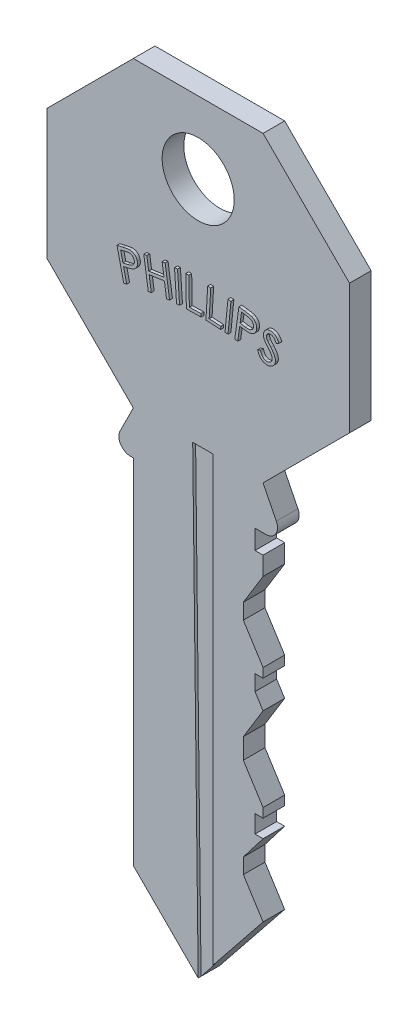
from build123d import *

# Parameters (mm, degrees)
CROQUIS1_W              = 21
CROQUIS1_H              = 21
SALIENTE_EXTRUIR1_DEPTH = 1.5
CROQUIS2_R              = 2.5
CORTAR_EXTRUIR1_DEPTH   = 1.5
SALIENTE_EXTRUIR2_DEPTH = 1.5
REDONDEO1_R             = 0.8
CORTAR_EXTRUIR2_DEPTH   = 1.5
CORTAR_EXTRUIR3_DEPTH   = 0.2
SALIENTE_EXTRUIR3_DEPTH = 0.2


with BuildPart() as part:
    # Croquis1 → Saliente-Extruir1 (new body)
    with BuildSketch(Plane.XY):
        Rectangle(CROQUIS1_W, CROQUIS1_H)
    extrude(amount=SALIENTE_EXTRUIR1_DEPTH)

    # Croquis2 → Cortar-Extruir1 (cut)
    with BuildSketch(Plane.XY.offset(1.5)):
        with Locations((0, 5.5)):
            Circle(CROQUIS2_R)
        Polygon((-10.5, 4.5), (-4.5, 10.5), (-10.029650862, 11.989113264), (-12.962341251, 10.5), align=None)
        Polygon((12.962341251, 10.5), (10.029650862, 11.989113264), (4.5, 10.5), (10.5, 4.5), align=None)
        Polygon((10.029650862, -11.989113264), (4.5, -10.5), (10.5, -4.5), (12.962341251, -10.5), align=None)
        Polygon((-10.029650862, -11.989113264), (-4.5, -10.5), (-10.5, -4.5), (-12.962341251, -10.5), align=None)
    extrude(amount=-CORTAR_EXTRUIR1_DEPTH, mode=Mode.SUBTRACT)

    # Croquis3 → Saliente-Extruir2 (add)
    with BuildSketch(Plane.XY.offset(1.5)):
        Polygon((-4.5, -10.5), (-6, -13.5), (-4.5, -13.5), (-4.5, -38), (0, -42.5), (4.5, -38), (4.5, -13.5), (6, -13.5), (4.5, -10.5), align=None)
    extrude(amount=-SALIENTE_EXTRUIR2_DEPTH)

    # Redondeo1
    redondeo1_edges = [part.edges().sort_by_distance(p)[0] for p in [
        (6, -13.5, 0.75),
        (-6, -13.5, 0.75),
    ]]
    fillet(redondeo1_edges, radius=REDONDEO1_R)

    # Croquis4 → Cortar-Extruir2 (cut)
    with BuildSketch(Plane.XY.offset(1.5)):
        Polygon((4.5, -13.5), (3.944152293, -13.5), (3.944152293, -14.839652089), (4.5, -14.839652089), (4.5, -16.123338429), (3.133403026, -18.352898915), (3.133403026, -19.433897938), (4.5, -21.595895985), (4.5, -22.237739155), (3.944152293, -22.237739155), (3.944152293, -23.318738178), (4.5, -24.198106184), (3.133403026, -26.427666669), (3.133403026, -27.846097212), (4.5, -30.008095259), (4.5, -30.649317108), (3.944152293, -30.649317108), (3.944152293, -31.879924867), (4.5, -31.879924867), (3.133403026, -33.659573012), (3.133403026, -34.719788927), (4.5, -36.881786974), (0, -42.5), (6.693882672, -39.265767585), (9.601874389, -27.136881941), align=None)
    extrude(amount=-CORTAR_EXTRUIR2_DEPTH, mode=Mode.SUBTRACT)

    # Croquis5 → Cortar-Extruir3 (cut)
    with BuildSketch(Plane.XY.offset(1.5)):
        Polygon((0, -42.5), (-0.381234515, -10.5), (1.019575306, -10.5), (1.019575306, -41.227068608), align=None)
    extrude(amount=-CORTAR_EXTRUIR3_DEPTH, mode=Mode.SUBTRACT)

    # Croquis6 → Saliente-Extruir3 (add)
    # profile 1 of 8: a face of its own
    with BuildSketch(Plane.XY.offset(1.5)):
        with BuildLine():
            Line((-5.431672509, -1.091944484), (-5.024197215, -0.998661898))
            add(Edge.make_bspline(
                [(-5.024197215, -0.998661898), (-4.996085863, -0.992375574), (-4.942329592, -0.980354476), (-4.865022948, -0.964180371), (-4.794639874, -0.950544968), (-4.731172174, -0.939479576), (-4.67463325, -0.930915996), (-4.62503631, -0.924697823), (-4.582135463, -0.92164239), (-4.555808977, -0.921247844), (-4.5437919, -0.921067748)],
                knots=[0, 0, 0, 0, 1.418251892, 2.712069135, 3.888501382, 4.947889383, 5.883818778, 6.703809145, 7.408336306, 8, 8, 8, 8], degree=3))
            add(Edge.make_bspline(
                [(-4.5437919, -0.921067748), (-4.528512619, -0.921702267), (-4.498428284, -0.922951612), (-4.45402837, -0.928492029), (-4.410948154, -0.937496806), (-4.369155748, -0.949558327), (-4.328843068, -0.965603841), (-4.289792337, -0.984622983), (-4.252133474, -1.007135928), (-4.21609162, -1.032587088), (-4.181900607, -1.060806756), (-4.151205777, -1.092963773), (-4.12227739, -1.127185784), (-4.09757897, -1.16521071), (-4.075156183, -1.205758158), (-4.056378525, -1.249459207), (-4.039899502, -1.295998586), (-4.03187627, -1.328462781), (-4.027769598, -1.3450795)],
                knots=[0, 0, 0, 0, 1.013006225, 1.994571563, 2.960690979, 3.926810396, 4.87288566, 5.832034986, 6.802140658, 7.77653137, 8.753798254, 9.73397761, 10.718442704, 11.718465043, 12.732725925, 13.785389559, 14.86645701, 16, 16, 16, 16], degree=3))
            add(Edge.make_bspline(
                [(-4.027769598, -1.3450795), (-4.02428606, -1.361855859), (-4.017472845, -1.394667598), (-4.011372834, -1.443714762), (-4.009920541, -1.491218739), (-4.011269137, -1.537481404), (-4.017316677, -1.582170065), (-4.026959694, -1.625557968), (-4.041314451, -1.667083003), (-4.058340187, -1.707503751), (-4.079997815, -1.745594694), (-4.103819806, -1.782307075), (-4.131923037, -1.816170895), (-4.162218904, -1.848839871), (-4.196847025, -1.878140039), (-4.23403271, -1.90596197), (-4.274178876, -1.93207132), (-4.303093119, -1.946863685), (-4.317793636, -1.954384388)],
                knots=[0, 0, 0, 0, 1.118491015, 2.187580456, 3.221808766, 4.219148274, 5.205842779, 6.161762592, 7.116032843, 8.070882995, 9.020994407, 9.973120429, 10.924351595, 11.890462266, 12.878407472, 13.880602315, 14.922460382, 16, 16, 16, 16], degree=3))
            add(Edge.make_bspline(
                [(-4.317793636, -1.954384388), (-4.330035319, -1.960024961), (-4.356750169, -1.972334303), (-4.401465226, -1.989368635), (-4.453688918, -2.007751286), (-4.514063517, -2.026122405), (-4.582026995, -2.045597862), (-4.657855496, -2.065448101), (-4.741387294, -2.086247036), (-4.799876179, -2.099898638), (-4.830423845, -2.107028619)],
                knots=[0, 0, 0, 0, 0.60366241, 1.317363924, 2.142366788, 3.083624026, 4.143800012, 5.309447408, 6.594774019, 8, 8, 8, 8], degree=3))
            Line((-4.830423845, -2.107028619), (-4.976707899, -2.140525547))
            Line((-4.976707899, -2.140525547), (-4.758765859, -3.092007919))
            Line((-4.758765859, -3.092007919), (-4.963139523, -3.138649211))
            Line((-4.963139523, -3.138649211), (-5.431672509, -1.091944484))
        make_face()
        with BuildLine():
            Line((-5.181929587, -1.244164703), (-5.022501168, -1.939967988))
            Line((-5.022501168, -1.939967988), (-4.675235543, -1.864917908))
            add(Edge.make_bspline(
                [(-4.675235543, -1.864917908), (-4.658248679, -1.860925433), (-4.625573433, -1.853245669), (-4.578654008, -1.840408531), (-4.535704852, -1.827310706), (-4.496212844, -1.814343492), (-4.460889953, -1.800165394), (-4.428814718, -1.786651753), (-4.401231692, -1.771434274), (-4.369164038, -1.752171455), (-4.334711398, -1.724656437), (-4.299870081, -1.686872027), (-4.271449458, -1.644472088), (-4.250527339, -1.597628834), (-4.235945677, -1.548274558), (-4.229363318, -1.497119582), (-4.229189089, -1.445010357), (-4.235940177, -1.41073565), (-4.239351462, -1.39341684)],
                knots=[0, 0, 0, 0, 1.14451667, 2.201546071, 3.189871822, 4.089899925, 4.926582907, 5.686219818, 6.370625557, 6.990727912, 8.138880893, 9.24769648, 10.350761232, 11.470951561, 12.600501644, 13.713649465, 14.844720316, 16, 16, 16, 16], degree=3))
            add(Edge.make_bspline(
                [(-4.239351462, -1.39341684), (-4.243987633, -1.376726491), (-4.253131183, -1.34380945), (-4.274737072, -1.297171669), (-4.303333309, -1.254772022), (-4.337779421, -1.216752653), (-4.376185203, -1.18362745), (-4.41900452, -1.157873446), (-4.464645815, -1.138827239), (-4.505696955, -1.129780357), (-4.540881046, -1.125805522), (-4.570940804, -1.125102143), (-4.604190568, -1.126536726), (-4.640946962, -1.129651602), (-4.681052756, -1.134043839), (-4.724361042, -1.141684541), (-4.771029636, -1.150481059), (-4.803161414, -1.157446451), (-4.819823551, -1.161058399)],
                knots=[0, 0, 0, 0, 1.164258512, 2.296174013, 3.441002044, 4.592605197, 5.739761761, 6.840767675, 7.941116125, 9.053198795, 9.656072046, 10.32210586, 11.074007543, 11.894648899, 12.804219987, 13.787711987, 14.85280401, 16, 16, 16, 16], degree=3))
            Line((-4.819823551, -1.161058399), (-5.181929587, -1.244164703))
        make_face(mode=Mode.SUBTRACT)
    # profile 2 of 8: a face of its own
    with BuildSketch(Plane.XY.offset(1.5)):
        Polygon((-3.572864861, -0.694461023), (-3.362979044, -0.663084153), (-3.23365546, -1.537820398), (-2.173202067, -1.381360061), (-2.302525652, -0.506623817), (-2.092639835, -0.475670959), (-1.784383291, -2.561384767), (-1.994269108, -2.592337625), (-2.143097233, -1.585733726), (-3.203550625, -1.742194062), (-3.0547225, -2.748797962), (-3.264608317, -2.780174831), align=None)
    # profile 3 of 8: a face of its own
    with BuildSketch(Plane.XY.offset(1.5)):
        Polygon((-1.443856263, -0.434787949), (-1.233546434, -0.420371549), (-1.090230462, -2.525589899), (-1.300540291, -2.540006298), align=None)
    # profile 4 of 8: a face of its own
    with BuildSketch(Plane.XY.offset(1.5)):
        Polygon((-0.663567699, -0.400348756), (-0.451561823, -0.396108639), (-0.41212873, -2.298225359), (0.396461682, -2.281264889), (0.400701799, -2.484366518), (-0.619894488, -2.505567106), align=None)
    # profile 5 of 8: a face of its own
    with BuildSketch(Plane.XY.offset(1.5)):
        Polygon((0.859241981, -0.39331503), (1.071247857, -0.405611371), (0.961852825, -2.307728091), (1.770443236, -2.354369384), (1.758570907, -2.557471013), (0.73797462, -2.49853338), align=None)
    # profile 6 of 8: a face of its own
    with BuildSketch(Plane.XY.offset(1.5)):
        Polygon((2.264071213, -0.479871029), (2.472684995, -0.500223593), (2.268311331, -2.585937402), (2.059697549, -2.565584838), align=None)
    # profile 7 of 8: a face of its own
    with BuildSketch(Plane.XY.offset(1.5)):
        with BuildLine():
            Line((3.026762536, -0.552738335), (3.442294053, -0.610403933))
            add(Edge.make_bspline(
                [(3.442294053, -0.610403933), (3.470855337, -0.614426795), (3.525624955, -0.622141107), (3.60394084, -0.634397027), (3.674779472, -0.646604745), (3.738109819, -0.658905296), (3.794149007, -0.671022826), (3.842711354, -0.683436643), (3.884191996, -0.694672611), (3.90862422, -0.704075862), (3.919731286, -0.708350648)],
                knots=[0, 0, 0, 0, 1.417789489, 2.718777917, 3.896378826, 4.950985233, 5.889930242, 6.71390826, 7.415333406, 8, 8, 8, 8], degree=3))
            add(Edge.make_bspline(
                [(3.919731286, -0.708350648), (3.9338249, -0.714352072), (3.961654562, -0.726202661), (4.001187199, -0.747557973), (4.038216345, -0.771504755), (4.073237408, -0.797524513), (4.104875976, -0.827219008), (4.134929598, -0.858670609), (4.162451254, -0.892902799), (4.186955204, -0.929894453), (4.20868745, -0.968737156), (4.226491634, -1.009527214), (4.240493194, -1.051991963), (4.25146126, -1.095994721), (4.256914009, -1.142118429), (4.259606823, -1.189708034), (4.258374331, -1.239071587), (4.254536435, -1.272308218), (4.252580511, -1.289246748)],
                knots=[0, 0, 0, 0, 1.012867312, 2.00003734, 2.967351041, 3.928455086, 4.881247219, 5.83358055, 6.804546972, 7.782107545, 8.76555172, 9.745211263, 10.720847546, 11.720861352, 12.739022095, 13.787632888, 14.872501595, 16, 16, 16, 16], degree=3))
            add(Edge.make_bspline(
                [(4.252580511, -1.289246748), (4.249854052, -1.306253307), (4.244522129, -1.339511707), (4.232577707, -1.387750688), (4.217333084, -1.433101935), (4.199094455, -1.475673511), (4.177824005, -1.515509474), (4.153045197, -1.552396398), (4.125562726, -1.587034818), (4.094459775, -1.61829137), (4.060891366, -1.646668884), (4.025229939, -1.67242901), (3.986918918, -1.69421895), (3.946765586, -1.713564303), (3.904261857, -1.729790029), (3.859324851, -1.742162654), (3.812369796, -1.752344201), (3.78013481, -1.755943891), (3.763694961, -1.757779734)],
                knots=[0, 0, 0, 0, 1.120605591, 2.19148094, 3.229944167, 4.231239178, 5.202507356, 6.164320874, 7.119646462, 8.075813104, 9.02865548, 9.978206508, 10.934328902, 11.892970145, 12.877004196, 13.890353063, 14.924079645, 16, 16, 16, 16], degree=3))
            add(Edge.make_bspline(
                [(3.763694961, -1.757779734), (3.750274484, -1.758779375), (3.720921824, -1.760965743), (3.672937761, -1.760982889), (3.617370719, -1.759242443), (3.554318626, -1.755286418), (3.483614269, -1.749391552), (3.405506967, -1.740592838), (3.319672934, -1.730588924), (3.260098012, -1.722543933), (3.229016141, -1.718346641)],
                knots=[0, 0, 0, 0, 0.601266309, 1.315062545, 2.142914088, 3.085792928, 4.138059921, 5.313427469, 6.59834143, 8, 8, 8, 8], degree=3))
            Line((3.229016141, -1.718346641), (3.080188016, -1.697570065))
            Line((3.080188016, -1.697570065), (2.945776291, -2.667284942))
            Line((2.945776291, -2.667284942), (2.737162509, -2.638452143))
            Line((2.737162509, -2.638452143), (3.026762536, -0.552738335))
        make_face()
        with BuildLine():
            Line((3.20696753, -0.784248751), (3.108596804, -1.493196401))
            Line((3.108596804, -1.493196401), (3.46095057, -1.54619787))
            add(Edge.make_bspline(
                [(3.46095057, -1.54619787), (3.478188248, -1.548354699), (3.511501209, -1.552522915), (3.559800245, -1.557958909), (3.604808666, -1.560613741), (3.646363025, -1.562704966), (3.684583651, -1.56223673), (3.7192271, -1.560053259), (3.750608224, -1.556995437), (3.787337025, -1.549658141), (3.829505236, -1.536157507), (3.875637395, -1.513068444), (3.917643165, -1.483548523), (3.953692541, -1.446678554), (3.985222326, -1.405654808), (4.009374936, -1.359932351), (4.027891479, -1.311130175), (4.034050415, -1.276667766), (4.037182541, -1.259141914)],
                knots=[0, 0, 0, 0, 1.136516206, 2.196393175, 3.17861268, 4.08548325, 4.917682056, 5.677268992, 6.356274008, 6.978240609, 8.124456561, 9.240899508, 10.341532932, 11.466063387, 12.601488362, 13.714288119, 14.837601549, 16, 16, 16, 16], degree=3))
            add(Edge.make_bspline(
                [(4.037182541, -1.259141914), (4.038823075, -1.241913484), (4.042064933, -1.207868398), (4.037976906, -1.156645012), (4.026462531, -1.106811695), (4.007659708, -1.05894991), (3.983087772, -1.014415012), (3.952588874, -0.974553976), (3.916226637, -0.94086599), (3.881254902, -0.917655741), (3.849763981, -0.90119206), (3.821823894, -0.890072441), (3.790094449, -0.879402671), (3.754658103, -0.869478873), (3.715429867, -0.859488606), (3.672197991, -0.850911524), (3.625176307, -0.842235399), (3.592413646, -0.837555574), (3.575433743, -0.835130162)],
                knots=[0, 0, 0, 0, 1.160107035, 2.292486556, 3.431841461, 4.582480303, 5.733588538, 6.836279487, 7.9373771, 9.045321995, 9.643711973, 10.320343134, 11.061494696, 11.890439658, 12.790266228, 13.778412631, 14.848618041, 16, 16, 16, 16], degree=3))
            Line((3.575433743, -0.835130162), (3.20696753, -0.784248751))
        make_face(mode=Mode.SUBTRACT)
    # profile 8 of 8: a face of its own
    with BuildSketch(Plane.XY.offset(1.5)):
        with BuildLine():
            Line((4.325291999, -2.487044592), (4.522881476, -2.422170793))
            add(Edge.make_bspline(
                [(4.522881476, -2.422170793), (4.531961274, -2.452319128), (4.549341921, -2.510029392), (4.582675661, -2.589961935), (4.619171275, -2.660377671), (4.66089987, -2.720152416), (4.706594111, -2.770436672), (4.756899345, -2.810236626), (4.811623437, -2.840312929), (4.850929472, -2.851294989), (4.870571113, -2.856782839)],
                knots=[0, 0, 0, 0, 1.291853408, 2.472879578, 3.550092808, 4.541686389, 5.457391863, 6.329172418, 7.16506983, 8, 8, 8, 8], degree=3))
            add(Edge.make_bspline(
                [(4.870571113, -2.856782839), (4.887615716, -2.860067461), (4.921352247, -2.866568741), (4.972818673, -2.868243752), (5.024108156, -2.864717435), (5.074522697, -2.85404202), (5.122617611, -2.837612386), (5.167236112, -2.816117377), (5.207021745, -2.788532597), (5.242283646, -2.756319694), (5.272302894, -2.719977189), (5.296507057, -2.680616894), (5.315870243, -2.639009532), (5.323702876, -2.609590512), (5.327655782, -2.594743577)],
                knots=[0, 0, 0, 0, 1.064757967, 2.107484569, 3.152233221, 4.216424714, 5.262471191, 6.268105896, 7.248233143, 8.225279432, 9.193491207, 10.133099009, 11.05782868, 12, 12, 12, 12], degree=3))
            add(Edge.make_bspline(
                [(5.327655782, -2.594743577), (5.330642416, -2.577412778), (5.336684625, -2.542351135), (5.334963286, -2.487805884), (5.324201073, -2.432073125), (5.310805788, -2.395863133), (5.303911123, -2.377225548)],
                knots=[0, 0, 0, 0, 0.947869012, 1.917617609, 2.928180434, 4, 4, 4, 4], degree=3))
            add(Edge.make_bspline(
                [(5.303911123, -2.377225548), (5.297820365, -2.363596847), (5.284970927, -2.334844901), (5.26206136, -2.290870954), (5.234225168, -2.244181565), (5.202059508, -2.194615778), (5.164804725, -2.142393295), (5.123437393, -2.087073544), (5.077514009, -2.02880064), (5.044797342, -1.989598016), (5.027879473, -1.969326242)],
                knots=[0, 0, 0, 0, 0.724804189, 1.529091489, 2.406033567, 3.363605743, 4.397647578, 5.520513595, 6.717851405, 8, 8, 8, 8], degree=3))
            add(Edge.make_bspline(
                [(5.027879473, -1.969326242), (5.011006535, -1.949159656), (4.978849982, -1.910726045), (4.933636374, -1.854986447), (4.893943611, -1.80392795), (4.859415632, -1.757583345), (4.830069627, -1.716061554), (4.805809909, -1.679296195), (4.786675768, -1.647219004), (4.777281219, -1.626659695), (4.77304841, -1.617396488)],
                knots=[0, 0, 0, 0, 1.448791507, 2.761116266, 3.954352388, 5.011922334, 5.945301079, 6.755289071, 7.43918277, 8, 8, 8, 8], degree=3))
            add(Edge.make_bspline(
                [(4.77304841, -1.617396488), (4.767017199, -1.603354322), (4.755126846, -1.575670607), (4.741593992, -1.533073416), (4.731900951, -1.490635752), (4.725394068, -1.448265977), (4.722474231, -1.406004179), (4.722836774, -1.363603773), (4.726892259, -1.321260766), (4.732784665, -1.293407208), (4.735735376, -1.279459121)],
                knots=[0, 0, 0, 0, 1.059114621, 2.088013168, 3.0935466, 4.074767526, 5.057113285, 6.027311119, 7.012146491, 8, 8, 8, 8], degree=3))
            add(Edge.make_bspline(
                [(4.735735376, -1.279459121), (4.741356532, -1.25777878), (4.752449254, -1.214995057), (4.779280519, -1.154904031), (4.81305778, -1.099595066), (4.853835063, -1.049520495), (4.900902187, -1.005254696), (4.95377302, -0.968219076), (5.011863767, -0.938551431), (5.074421884, -0.916939981), (5.139710746, -0.902226572), (5.20656578, -0.897103088), (5.274200577, -0.898998218), (5.318690943, -0.907804693), (5.341224158, -0.912264944)],
                knots=[0, 0, 0, 0, 1.01908457, 2.01104917, 2.985231066, 3.964889633, 4.944484694, 5.920006754, 6.896399995, 7.906655493, 8.928605263, 9.936744266, 10.955014545, 12, 12, 12, 12], degree=3))
            add(Edge.make_bspline(
                [(5.341224158, -0.912264944), (5.364764908, -0.918544899), (5.411510279, -0.93101514), (5.477557651, -0.961100194), (5.539724049, -0.998433852), (5.587357277, -1.037232918), (5.623124716, -1.073351524), (5.650604443, -1.103758748), (5.676559145, -1.138974751), (5.703048218, -1.177305639), (5.728207962, -1.220117192), (5.753970572, -1.266197265), (5.778150968, -1.316770117), (5.793993141, -1.351795227), (5.802124932, -1.369773625)],
                knots=[0, 0, 0, 0, 1.293395107, 2.568322243, 3.84287286, 5.140865654, 5.820992122, 6.544875647, 7.317362517, 8.144800739, 9.021123634, 9.956086172, 10.95085855, 12, 12, 12, 12], degree=3))
            Line((5.802124932, -1.369773625), (5.606231503, -1.458392081))
            add(Edge.make_bspline(
                [(5.606231503, -1.458392081), (5.599665354, -1.443940205), (5.587033121, -1.416137076), (5.567517607, -1.376467173), (5.547958527, -1.340506993), (5.529084431, -1.307843535), (5.510302675, -1.278909888), (5.492177265, -1.253223102), (5.473935946, -1.231208744), (5.450505235, -1.206383342), (5.419012381, -1.180992587), (5.379194723, -1.154909534), (5.335189232, -1.135733318), (5.304313574, -1.127285409), (5.2886467, -1.122998785)],
                knots=[0, 0, 0, 0, 1.186571879, 2.282777111, 3.303908296, 4.246183248, 5.101913279, 5.881821068, 6.59472938, 7.23739596, 8.430534937, 9.608751735, 10.786636888, 12, 12, 12, 12], degree=3))
            add(Edge.make_bspline(
                [(5.2886467, -1.122998785), (5.268650964, -1.119465727), (5.230101482, -1.112654397), (5.172415922, -1.114213456), (5.118300672, -1.127176148), (5.068916912, -1.150620274), (5.025367403, -1.182167138), (4.990477311, -1.221693859), (4.963487886, -1.267525315), (4.953915682, -1.301775189), (4.949013287, -1.319316226)],
                knots=[0, 0, 0, 0, 1.110116415, 2.140176817, 3.135319745, 4.136137325, 5.116231801, 6.05933874, 7.006092358, 8, 8, 8, 8], degree=3))
            add(Edge.make_bspline(
                [(4.949013287, -1.319316226), (4.94675533, -1.330443587), (4.942241522, -1.352687932), (4.940486093, -1.386864907), (4.941551484, -1.421254582), (4.946866118, -1.456227526), (4.956270832, -1.492812104), (4.972085053, -1.531163991), (4.992369255, -1.57255166), (5.009257657, -1.600008478), (5.018127202, -1.614428406)],
                knots=[0, 0, 0, 0, 0.872126693, 1.743440088, 2.62453057, 3.51462732, 4.458521912, 5.522303743, 6.698749469, 8, 8, 8, 8], degree=3))
            add(Edge.make_bspline(
                [(5.018127202, -1.614428406), (5.021466766, -1.619413032), (5.029465159, -1.631351421), (5.044974347, -1.651015843), (5.064995216, -1.676093496), (5.089453451, -1.706711882), (5.119378998, -1.742152201), (5.153519644, -1.78343058), (5.193042597, -1.829454505), (5.220944682, -1.861911421), (5.235645231, -1.879011739)],
                knots=[0, 0, 0, 0, 0.420138447, 1.006249053, 1.753027375, 2.668336572, 3.75083811, 5.001926597, 6.420428895, 8, 8, 8, 8], degree=3))
            add(Edge.make_bspline(
                [(5.235645231, -1.879011739), (5.253465043, -1.899803399), (5.288049962, -1.94015612), (5.33571513, -2.000759602), (5.378764017, -2.058544592), (5.417107566, -2.113737237), (5.450600774, -2.166362935), (5.478883486, -2.216779471), (5.502115518, -2.264540601), (5.521349887, -2.310003869), (5.535574273, -2.354128505), (5.547358379, -2.396923195), (5.555186865, -2.439235946), (5.561011339, -2.480798879), (5.5631798, -2.521948181), (5.56160165, -2.562302041), (5.55823979, -2.602085158), (5.552922397, -2.62799661), (5.550261951, -2.640960858)],
                knots=[0, 0, 0, 0, 1.535311931, 2.979753137, 4.322305946, 5.575398454, 6.747318007, 7.818840334, 8.814840006, 9.724416, 10.584041114, 11.412599676, 12.211518629, 12.99499712, 13.764767267, 14.518041604, 15.258533399, 16, 16, 16, 16], degree=3))
            add(Edge.make_bspline(
                [(5.550261951, -2.640960858), (5.545550861, -2.659169342), (5.5362736, -2.695026188), (5.515911472, -2.746427229), (5.491004504, -2.794790064), (5.461016768, -2.840031569), (5.426481327, -2.882341114), (5.386773192, -2.92150457), (5.34201703, -2.957468944), (5.293349658, -2.990332526), (5.241604031, -3.018443471), (5.188297468, -3.041567553), (5.133820593, -3.05924612), (5.077882004, -3.070368608), (5.020996098, -3.077271133), (4.962906521, -3.076604088), (4.903765843, -3.072098811), (4.864571149, -3.063992785), (4.844706396, -3.059884469)],
                knots=[0, 0, 0, 0, 0.989993804, 1.949533814, 2.905253247, 3.851031424, 4.80340983, 5.777399658, 6.783225479, 7.823992748, 8.866835222, 9.880648378, 10.881363192, 11.877219128, 12.881141724, 13.893723844, 14.932491814, 16, 16, 16, 16], degree=3))
            add(Edge.make_bspline(
                [(4.844706396, -3.059884469), (4.829373858, -3.056167649), (4.799091705, -3.048826835), (4.755216916, -3.033713419), (4.713087085, -3.015953747), (4.672824478, -2.995028737), (4.634011427, -2.971728918), (4.597034999, -2.945329581), (4.561941885, -2.916083254), (4.528381037, -2.884015036), (4.496980444, -2.848203299), (4.467211687, -2.808433692), (4.438828345, -2.76491667), (4.412525428, -2.717072024), (4.388054561, -2.665325994), (4.365122442, -2.609571048), (4.343938956, -2.549837237), (4.331605463, -2.508304847), (4.325291999, -2.487044592)],
                knots=[0, 0, 0, 0, 0.926567619, 1.829994715, 2.723094834, 3.610811634, 4.493854568, 5.381066222, 6.27744237, 7.176085445, 8.105774081, 9.072450113, 10.092889092, 11.15602872, 12.277879167, 13.454608931, 14.697025037, 16, 16, 16, 16], degree=3))
        make_face()
    extrude(amount=SALIENTE_EXTRUIR3_DEPTH)


solid = part.part
